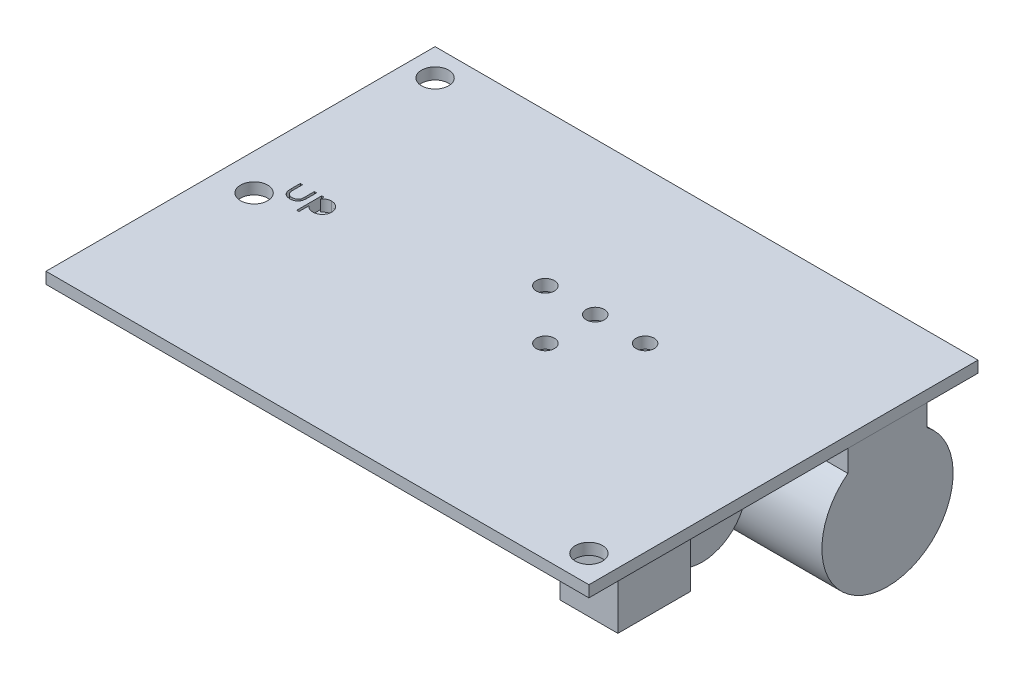
from build123d import *

# Parameters (mm, degrees)
SKETCH1_W           = 76.2
SKETCH1_H           = 54.61
BOSS_EXTRUDE1_DEPTH = 1.6002
SKETCH2_R           = 1.27
CUT_EXTRUDE1_DEPTH  = 94.761680553
BOSS_EXTRUDE2_DEPTH = 76.2
SKETCH5_R           = 1.905
CUT_EXTRUDE4_DEPTH  = 12.7
CUT_EXTRUDE2_DEPTH  = 97.113651975
SKETCH6_W           = 8.128
SKETCH6_H           = 10.16
BOSS_EXTRUDE3_DEPTH = 9.906
SKETCH8_R           = 6.2484
BOSS_EXTRUDE5_DEPTH = 27.0002


with BuildPart() as part:
    # Sketch1 → Boss-Extrude1 (new body)
    with BuildSketch(Plane(origin=(0, 0, 0), x_dir=(1, 0, 0), z_dir=(0, 1, 0))):
        with Locations((38.1, 27.305)):
            Rectangle(SKETCH1_W, SKETCH1_H)
    extrude(amount=BOSS_EXTRUDE1_DEPTH)

    # Sketch2 → Cut-Extrude1 (cut, through all)
    with BuildSketch(Plane(origin=(0, 1.6002, 0), x_dir=(1, 0, 0), z_dir=(0, 1, 0))):
        with Locations(Location((43.815, 33.274, 0), (0, 0, 270))):
            Circle(SKETCH2_R)
        with Locations(Location((36.815, 33.274, 0), (0, 0, 270))):
            Circle(SKETCH2_R)
        with Locations(Location((43.815, 26.274, 0), (0, 0, 270))):
            Circle(SKETCH2_R)
        with Locations(Location((50.815, 33.274, 0), (0, 0, 270))):
            Circle(SKETCH2_R)
    extrude(amount=-CUT_EXTRUDE1_DEPTH, mode=Mode.SUBTRACT)

    # Sketch5 → Cut-Extrude4 (cut)
    with BuildSketch(Plane(origin=(0, 1.6002, 0), x_dir=(1, 0, 0), z_dir=(0, 1, 0))):
        with Locations(Location((5.08, 24.13, 0), (0, 0, 270))):
            Circle(SKETCH5_R)
        with Locations(Location((72.39, 3.81, 0), (0, 0, 270))):
            Circle(SKETCH5_R)
        with Locations(Location((3.81, 50.8, 0), (0, 0, 270))):
            Circle(SKETCH5_R)
    extrude(amount=-CUT_EXTRUDE4_DEPTH, mode=Mode.SUBTRACT)

    # Sketch4 → Cut-Extrude2 (cut, through all)
    # profile 1 of 2: a face of its own
    with BuildSketch(Plane(origin=(0, 1.6002, 0), x_dir=(1, 0, 0), z_dir=(0, 1, 0))):
        with BuildLine():
            Line((7.174244274, 28.518170446), (7.488346838, 28.518170446))
            Line((7.488346838, 28.518170446), (7.488346838, 27.331872369))
            add(Edge.make_bspline(
                [(7.488346838, 27.331872369), (7.488488743, 27.29704962), (7.488760201, 27.230435332), (7.490601142, 27.134580145), (7.494931235, 27.047163433), (7.50034506, 26.968134696), (7.507307196, 26.897507304), (7.515590556, 26.835527947), (7.524848978, 26.781493763), (7.533911692, 26.748950407), (7.538126486, 26.733815478)],
                knots=[0, 0, 0, 0, 1.388932606, 2.656963016, 3.823490214, 4.879454478, 5.816252168, 6.653371382, 7.373723809, 8, 8, 8, 8], degree=3))
            add(Edge.make_bspline(
                [(7.538126486, 26.733815478), (7.544887941, 26.714792607), (7.558270282, 26.677142346), (7.582543766, 26.622753341), (7.612572102, 26.572378059), (7.64543193, 26.524073986), (7.683331338, 26.479271999), (7.725790809, 26.438047755), (7.771389046, 26.398843664), (7.839144069, 26.352458872), (7.931803335, 26.302743542), (8.053456091, 26.259847724), (8.185360316, 26.234211904), (8.276525036, 26.231237649), (8.323382896, 26.229708908)],
                knots=[0, 0, 0, 0, 0.725840625, 1.436591201, 2.137033971, 2.831655856, 3.53531722, 4.242432219, 4.957935707, 5.694543706, 7.190802206, 8.724350549, 10.316345118, 12, 12, 12, 12], degree=3))
            add(Edge.make_bspline(
                [(8.323382896, 26.229708908), (8.370236404, 26.231270156), (8.460889272, 26.234290883), (8.591344241, 26.259074422), (8.710595656, 26.300480111), (8.817446607, 26.358287523), (8.911412447, 26.429029586), (8.989716866, 26.512038394), (9.054324121, 26.604687781), (9.082533541, 26.67381206), (9.096720236, 26.708575094)],
                knots=[0, 0, 0, 0, 1.157059328, 2.238695713, 3.266970494, 4.264342957, 5.228770407, 6.160125903, 7.074715775, 8, 8, 8, 8], degree=3))
            add(Edge.make_bspline(
                [(9.096720236, 26.708575094), (9.100914466, 26.722541392), (9.110186884, 26.753417468), (9.120149236, 26.805797216), (9.129123697, 26.868261821), (9.136786874, 26.941220029), (9.142252036, 27.024481182), (9.145198063, 27.118019258), (9.148526338, 27.221540618), (9.148576854, 27.294008377), (9.148603249, 27.331872369)],
                knots=[0, 0, 0, 0, 0.557542046, 1.232589297, 2.036731608, 2.971723315, 4.038036528, 5.22795436, 6.551621927, 8, 8, 8, 8], degree=3))
            Line((9.148603249, 27.331872369), (9.148603249, 28.518170446))
            Line((9.148603249, 28.518170446), (9.462705813, 28.518170446))
            Line((9.462705813, 28.518170446), (9.462705813, 27.272978138))
            add(Edge.make_bspline(
                [(9.462705813, 27.272978138), (9.462264118, 27.230670967), (9.46140717, 27.148589267), (9.455899826, 27.029305156), (9.446450214, 26.918142911), (9.432107529, 26.815043691), (9.415241854, 26.720086209), (9.393485581, 26.633148763), (9.367507343, 26.554499209), (9.338201828, 26.482757432), (9.303579961, 26.417710538), (9.26675294, 26.355974722), (9.224228168, 26.299081786), (9.179457934, 26.244199649), (9.129656278, 26.194058122), (9.075756419, 26.147506646), (9.018516999, 26.103833614), (8.956667801, 26.064742335), (8.891111738, 26.029525689), (8.821767881, 25.998309611), (8.747786883, 25.973607034), (8.670123246, 25.952296368), (8.588396467, 25.935581899), (8.502685334, 25.923795333), (8.413018718, 25.916570002), (8.351909258, 25.915932957), (8.320578409, 25.915606344)],
                knots=[0, 0, 0, 0, 1.493040784, 2.896703357, 4.213163133, 5.428574705, 6.569057535, 7.615249723, 8.588095153, 9.490268104, 10.346124644, 11.18633936, 12.024365274, 12.850166724, 13.684164916, 14.514361689, 15.362232829, 16.222528818, 17.093394965, 17.986930858, 18.902426812, 19.842810585, 20.827885679, 21.843828298, 22.894529745, 24, 24, 24, 24], degree=3))
            add(Edge.make_bspline(
                [(8.320578409, 25.915606344), (8.289481895, 25.915946051), (8.22837435, 25.916613607), (8.138703106, 25.923755415), (8.052754499, 25.935563585), (7.970834101, 25.952418803), (7.892859703, 25.973457873), (7.818515464, 25.998461408), (7.748671901, 26.02954189), (7.682489897, 26.064519447), (7.620487508, 26.104084723), (7.56237893, 26.147452762), (7.508242078, 26.194558825), (7.45806501, 26.245206183), (7.412552033, 26.300023119), (7.371135991, 26.358568679), (7.333179286, 26.420262768), (7.298826496, 26.48632593), (7.26931474, 26.55889794), (7.243259494, 26.639195037), (7.221948856, 26.728097554), (7.204606388, 26.825529482), (7.190654947, 26.931024524), (7.180968805, 27.045192939), (7.175552974, 27.167756631), (7.174689913, 27.252406521), (7.174244274, 27.296115158)],
                knots=[0, 0, 0, 0, 1.083640291, 2.129454052, 3.13281866, 4.105697902, 5.042300162, 5.946461698, 6.836384745, 7.703652036, 8.553297018, 9.397182691, 10.228592656, 11.052265423, 11.879314572, 12.708807002, 13.549817954, 14.402308542, 15.300838682, 16.27712199, 17.341985831, 18.484375296, 19.725102775, 21.0496083, 22.476576903, 24, 24, 24, 24], degree=3))
            Line((7.174244274, 27.296115158), (7.174244274, 28.518170446))
        make_face()
    # profile 2 of 2: a face of its own
    with BuildSketch(Plane(origin=(0, 1.6002, 0), x_dir=(1, 0, 0), z_dir=(0, 1, 0))):
        with BuildLine():
            Line((10.180654531, 28.518170446), (10.494757095, 28.518170446))
            Line((10.494757095, 28.518170446), (10.494757095, 28.044913235))
            add(Edge.make_bspline(
                [(10.494757095, 28.044913235), (10.528114579, 28.087850968), (10.592938174, 28.171291861), (10.704663078, 28.27928199), (10.822589887, 28.370357294), (10.9497533, 28.441739827), (11.08417699, 28.495560638), (11.225309307, 28.535340088), (11.374348072, 28.558781563), (11.476244525, 28.561603224), (11.528210621, 28.563042241)],
                knots=[0, 0, 0, 0, 1.0828784, 2.104357462, 3.088488658, 4.04616522, 5.001424249, 5.969181776, 6.964304535, 8, 8, 8, 8], degree=3))
            add(Edge.make_bspline(
                [(11.528210621, 28.563042241), (11.573602224, 28.561729062), (11.663321112, 28.559133495), (11.795384341, 28.541560441), (11.922559724, 28.511442748), (12.044127778, 28.468041833), (12.161390844, 28.414386363), (12.272612943, 28.346669327), (12.379526499, 28.268263136), (12.479442688, 28.178030986), (12.571764056, 28.080402719), (12.651610237, 27.975380415), (12.720482141, 27.866417829), (12.776152438, 27.751825736), (12.819760785, 27.632506507), (12.850775463, 27.507978066), (12.869233106, 27.378702125), (12.871709558, 27.290799405), (12.872962223, 27.24633551)],
                knots=[0, 0, 0, 0, 1.041296284, 2.058176809, 3.050446431, 4.034000596, 5.01514041, 6.003636468, 7.015969324, 8.052561599, 9.08815499, 10.094063707, 11.074456064, 12.040834395, 13.011057502, 13.983766392, 14.980127149, 16, 16, 16, 16], degree=3))
            add(Edge.make_bspline(
                [(12.872962223, 27.24633551), (12.871736738, 27.200933202), (12.869319903, 27.111393297), (12.850574897, 26.9799062), (12.820618023, 26.853418826), (12.77755984, 26.732141563), (12.721918352, 26.616157911), (12.654213791, 26.505551515), (12.574327324, 26.400357812), (12.483026196, 26.302004912), (12.38397326, 26.211405599), (12.278095771, 26.13216753), (12.167036845, 26.065626154), (12.051364678, 26.010043195), (11.93008904, 25.968151011), (11.803775762, 25.93793321), (11.672493615, 25.919298714), (11.583192463, 25.916846572), (11.538026326, 25.915606344)],
                knots=[0, 0, 0, 0, 1.038740735, 2.04854663, 3.033179607, 4.009277356, 4.987731542, 5.972001279, 6.972200261, 8.005528982, 9.039189865, 10.040446548, 11.026516639, 11.997840187, 12.972163198, 13.956796175, 14.96660207, 16, 16, 16, 16], degree=3))
            add(Edge.make_bspline(
                [(11.538026326, 25.915606344), (11.487198754, 25.916901151), (11.386799398, 25.919458776), (11.240001727, 25.945378186), (11.098724875, 25.984115122), (10.964534051, 26.040814116), (10.836366238, 26.113069631), (10.714946432, 26.201179837), (10.599629679, 26.304960462), (10.530220922, 26.383692278), (10.494757095, 26.423919645)],
                knots=[0, 0, 0, 0, 1.014726462, 2.004382257, 2.969841629, 3.936926163, 4.907207904, 5.903978561, 6.929055279, 8, 8, 8, 8], degree=3))
            Line((10.494757095, 26.423919645), (10.494757095, 25.018170446))
            Line((10.494757095, 25.018170446), (10.180654531, 25.018170446))
            Line((10.180654531, 25.018170446), (10.180654531, 28.518170446))
        make_face()
        with BuildLine():
            add(Edge.make_bspline(
                [(11.525406133, 28.248939677), (11.489826571, 28.248299419), (11.419779583, 28.247038915), (11.317107364, 28.232064967), (11.218211936, 28.210327225), (11.124089985, 28.177415325), (11.033839368, 28.137016512), (10.948155204, 28.086534501), (10.867097636, 28.026882495), (10.790870606, 27.959203151), (10.722007312, 27.884628463), (10.661044384, 27.805040654), (10.609837079, 27.720540514), (10.567335059, 27.631915152), (10.534991776, 27.538469866), (10.512036057, 27.440736854), (10.497605704, 27.338609141), (10.495716766, 27.269053135), (10.494757095, 27.233715318)],
                knots=[0, 0, 0, 0, 1.05670511, 2.080379991, 3.077984906, 4.06214886, 5.038337365, 6.01289324, 7.01187578, 8.025460281, 9.038092164, 10.024533457, 11.000252242, 11.969694649, 12.940728589, 13.933144304, 14.949937299, 16, 16, 16, 16], degree=3))
            add(Edge.make_bspline(
                [(10.494757095, 27.233715318), (10.496347951, 27.187327205), (10.499464573, 27.096448964), (10.524801941, 26.963664842), (10.566037205, 26.838013187), (10.624565919, 26.72055215), (10.698513493, 26.612569315), (10.787611649, 26.515878708), (10.8910542, 26.431088117), (11.007121392, 26.359666863), (11.131543523, 26.301678797), (11.261329435, 26.260164587), (11.394694315, 26.234592358), (11.484862635, 26.231345539), (11.530313986, 26.229708908)],
                knots=[0, 0, 0, 0, 1.03728447, 2.032128127, 3.01272805, 3.987917167, 4.958271349, 5.931593992, 6.91984656, 7.941419022, 8.973179163, 9.983609215, 10.983593296, 12, 12, 12, 12], degree=3))
            add(Edge.make_bspline(
                [(11.530313986, 26.229708908), (11.574849754, 26.231265285), (11.663245247, 26.234354413), (11.793403368, 26.261092601), (11.919894007, 26.301937625), (12.040074179, 26.361497182), (12.152897667, 26.43448724), (12.254779221, 26.522047273), (12.343786134, 26.623537216), (12.419650489, 26.736545719), (12.480781974, 26.857721102), (12.526712214, 26.983102491), (12.553220788, 27.112247914), (12.556977576, 27.199245627), (12.558859659, 27.242829901)],
                knots=[0, 0, 0, 0, 1.00104056, 1.986885549, 2.97790532, 3.984399681, 4.995088187, 5.994304198, 6.996462723, 8.023150851, 9.048424203, 10.043036403, 11.019596776, 12, 12, 12, 12], degree=3))
            add(Edge.make_bspline(
                [(12.558859659, 27.242829901), (12.557404925, 27.28668489), (12.554506791, 27.374053194), (12.525959754, 27.502816097), (12.483059776, 27.628704073), (12.420500724, 27.748224623), (12.346299455, 27.860998706), (12.256552458, 27.960552585), (12.155936261, 28.047723257), (12.043247097, 28.119738667), (11.922306672, 28.177024162), (11.794991756, 28.218907801), (11.661948153, 28.24408155), (11.571320499, 28.247306057), (11.525406133, 28.248939677)],
                knots=[0, 0, 0, 0, 0.983928682, 1.960191568, 2.949917689, 3.96440592, 4.982380491, 5.975291189, 6.965713506, 7.964880129, 8.970154049, 9.96478489, 10.968906225, 12, 12, 12, 12], degree=3))
        make_face(mode=Mode.SUBTRACT)
    extrude(amount=-CUT_EXTRUDE2_DEPTH, mode=Mode.SUBTRACT)


with BuildPart() as body_2:
    # Sketch3 → Boss-Extrude2 (new body)
    with BuildSketch(Plane.ZY):
        with BuildLine():
            Line((-47.4726, 0), (-47.4726, -3.048))
            ThreePointArc((-47.4726, -3.048), (-41.91, -19.592770439), (-36.3474, -3.048))
            Line((-36.3474, -3.048), (-36.3474, 0))
            Line((-36.3474, 0), (-47.4726, 0))
        make_face()
    extrude(amount=-BOSS_EXTRUDE2_DEPTH)


with BuildPart() as cut_extrude2_kept_piece:
    # of the separate pieces the step leaves, the one the design keeps (cut_extrude2_pieces_kept)
    add(part.part.solids().sort_by_distance((0, 0, 0))[0])

    # Sketch6 → Boss-Extrude3 (add)
    with BuildSketch(Plane.XZ):
        with Locations((68.58, -12.7)):
            Rectangle(SKETCH6_W, SKETCH6_H)
    extrude(amount=BOSS_EXTRUDE3_DEPTH)


with BuildPart() as body_3:
    # Sketch8 → Boss-Extrude5 (new body)
    with BuildSketch(Plane.ZY.offset(-67.31)):
        with Locations((-24.765, -6.2484)):
            Circle(SKETCH8_R)
    extrude(amount=BOSS_EXTRUDE5_DEPTH)


solid = Compound([body_2.part, cut_extrude2_kept_piece.part, body_3.part])
